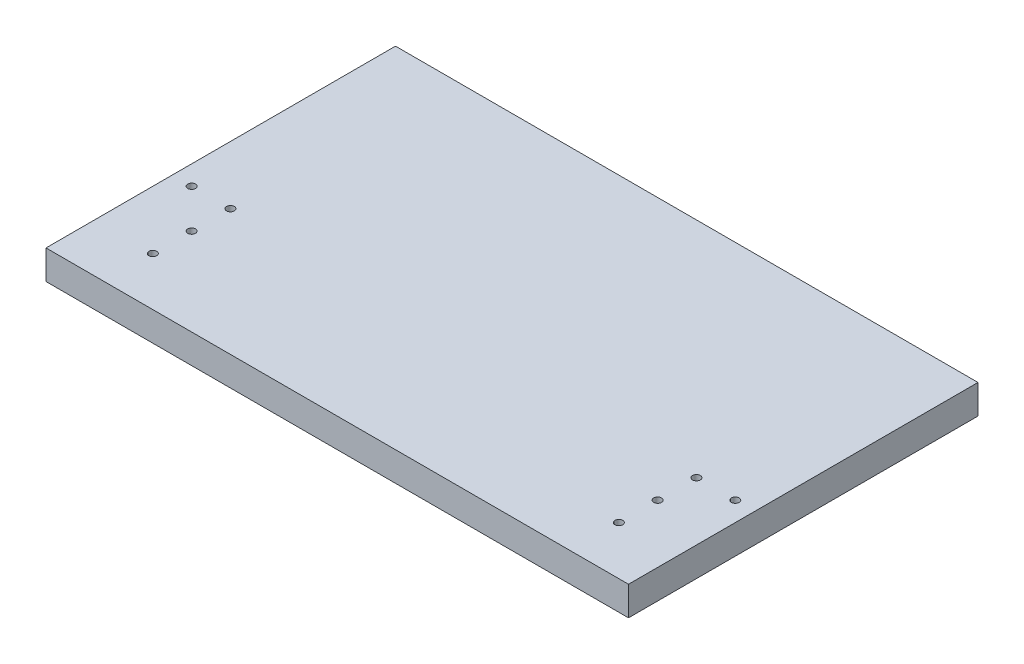
from build123d import *

# Parameters (mm, degrees)
CROQUIS1_W              = 300
CROQUIS1_H              = 180
SALIENTE_EXTRUIR1_DEPTH = 15
CROQUIS2_R              = 2
CORTAR_EXTRUIR1_DEPTH   = 10
CROQUIS3_R              = 2
CORTAR_EXTRUIR2_DEPTH   = 10


with BuildPart() as part:
    # Croquis1 → Saliente-Extruir1 (new body)
    with BuildSketch(Plane(origin=(0, 0, 0), x_dir=(1, 0, 0), z_dir=(0, 1, 0))):
        Rectangle(CROQUIS1_W, CROQUIS1_H)
    extrude(amount=SALIENTE_EXTRUIR1_DEPTH)

    # Croquis2 → Cortar-Extruir1 (cut)
    with BuildSketch(Plane(origin=(0, 15, 0), x_dir=(1, 0, 0), z_dir=(0, 1, 0))):
        with Locations(Location((-120, -65, 0), (0, 0, 270))):
            Circle(CROQUIS2_R)
        with Locations(Location((-120, -45, 0), (0, 0, 270))):
            Circle(CROQUIS2_R)
        with Locations(Location((120, -65, 0), (0, 0, 270))):
            Circle(CROQUIS2_R)
        with Locations(Location((120, -45, 0), (0, 0, 270))):
            Circle(CROQUIS2_R)
        with Locations(Location((-140, -25, 0), (0, 0, 270))):
            Circle(CROQUIS2_R)
        with Locations(Location((-120, -25, 0), (0, 0, 270))):
            Circle(CROQUIS2_R)
        with Locations(Location((120, -25, 0), (0, 0, 270))):
            Circle(CROQUIS2_R)
        with Locations(Location((140, -25, 0), (0, 0, 270))):
            Circle(CROQUIS2_R)
    extrude(amount=-CORTAR_EXTRUIR1_DEPTH, mode=Mode.SUBTRACT)

    # Croquis3 → Cortar-Extruir2 (cut)
    with BuildSketch(Plane.XZ):
        with Locations(Location((140, -65, 0), (0, 0, 270))):
            Circle(CROQUIS3_R)
    extrude(amount=-CORTAR_EXTRUIR2_DEPTH, mode=Mode.SUBTRACT)


solid = part.part
